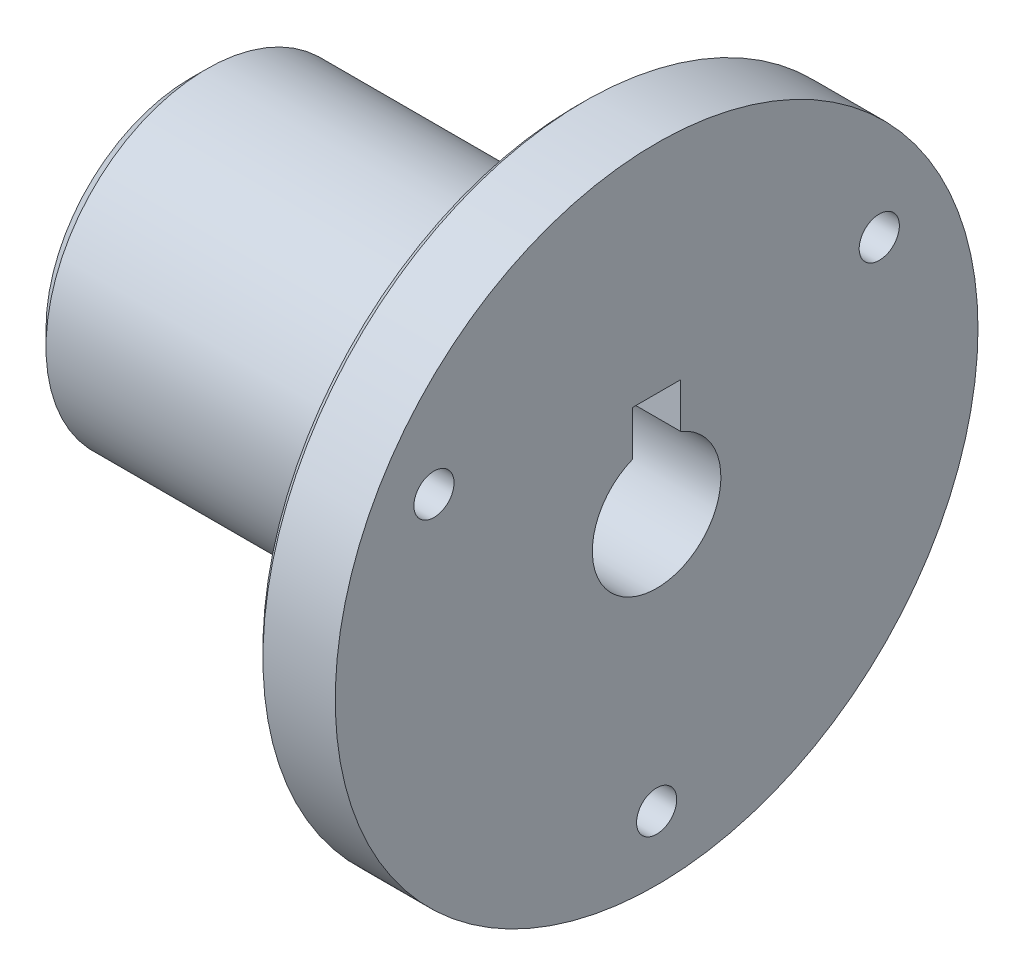
from build123d import *

# Parameters (mm, degrees)
SKETCH_1_R          = 10
EXTRUDE_1_DEPTH     = 24
SKETCH_2_R          = 20
EXTRUDE_2_DEPTH     = 5
M3X0_5_1_D          = 2.5
M3X0_5_1_DEPTH      = 7.5
M3X0_5_1_TIP        = 0.751075774
CUT_EXTRUDE_1_REACH = 42.509
CHAMFER_1_SIZE      = 0.5
CHAMFER_2_SIZE      = 1
CHAMFER_3_SIZE      = 0.5
CHAMFER_4_SIZE      = 2


with BuildPart() as part:
    # 草图1 → 凸台-拉伸1 (new body)
    with BuildSketch(Plane(origin=(0, 0, 0), x_dir=(0, 0, -1), z_dir=(1, 0, 0))):
        Circle(SKETCH_1_R)
        with BuildLine():
            Line((-1.5, 6), (-1.5, 6.5))
            Line((-1.5, 6.5), (1.5, 6.5))
            Line((1.5, 6.5), (1.5, 6))
            Line((1.5, 6), (1.5, 3.708099244))
            ThreePointArc((1.5, 3.708099244), (0, -4), (-1.5, 3.708099244))
            Line((-1.5, 3.708099244), (-1.5, 6))
        make_face(mode=Mode.SUBTRACT)
    extrude(amount=EXTRUDE_1_DEPTH)

    # 草图2 → 凸台-拉伸2 (add)
    with BuildSketch(Plane(origin=(24, 0, 0), x_dir=(0, 0, -1), z_dir=(1, 0, 0))):
        Circle(SKETCH_2_R)
    extrude(amount=EXTRUDE_2_DEPTH)

    # M3x0.5 螺纹孔1
    with Locations(Plane(origin=(29, 0, 0), x_dir=(0, 0, -1), z_dir=(1, 0, 0))):
        with Locations((-13.856406461, 8), (13.856406461, 8), (0, -16)):
            Hole(M3X0_5_1_D / 2, depth=M3X0_5_1_DEPTH)
            with Locations((0, 0, -(M3X0_5_1_DEPTH + M3X0_5_1_TIP / 2))):  # 118° drill point
                Cone(0, M3X0_5_1_D / 2, M3X0_5_1_TIP, mode=Mode.SUBTRACT)

    # 草图5 → 切除-拉伸1 (cut, up to next)
    with BuildSketch(Plane(origin=(29, 0, 0), x_dir=(0, 0, -1), z_dir=(1, 0, 0)), mode=Mode.PRIVATE) as cut_extrude_1_sk1:
        with BuildLine():
            Line((-1.5, 6.5), (-1.5, 3.708099244))
            ThreePointArc((-1.5, 3.708099244), (0, -4), (1.5, 3.708099244))
            Line((1.5, 3.708099244), (1.5, 6.5))
            Line((1.5, 6.5), (-1.5, 6.5))
        make_face()
    cut_extrude_1_tool1 = extrude(cut_extrude_1_sk1.sketch, amount=-CUT_EXTRUDE_1_REACH, mode=Mode.PRIVATE) & part.part
    add(cut_extrude_1_tool1.solids().sort_by_distance((29, 0.697639, 0))[0], mode=Mode.SUBTRACT)

    # 倒角1
    chamfer_1_edges = [part.edges().sort_by_distance(p)[0] for p in [
        (0, -4, 0),
    ]]
    chamfer(chamfer_1_edges, length=CHAMFER_1_SIZE)

    # 倒角2
    chamfer_2_edges = [part.edges().sort_by_distance(p)[0] for p in [
        (0, 0, 10),
    ]]
    chamfer(chamfer_2_edges, length=CHAMFER_2_SIZE)

    # 倒角3
    chamfer_3_edges = [part.edges().sort_by_distance(p)[0] for p in [
        (24, 0, 20),
    ]]
    chamfer(chamfer_3_edges, length=CHAMFER_3_SIZE)

    # 倒角4
    chamfer_4_edges = [part.edges().sort_by_distance(p)[0] for p in [
        (24, 0, 10),
    ]]
    chamfer(chamfer_4_edges, length=CHAMFER_4_SIZE)


solid = part.part
